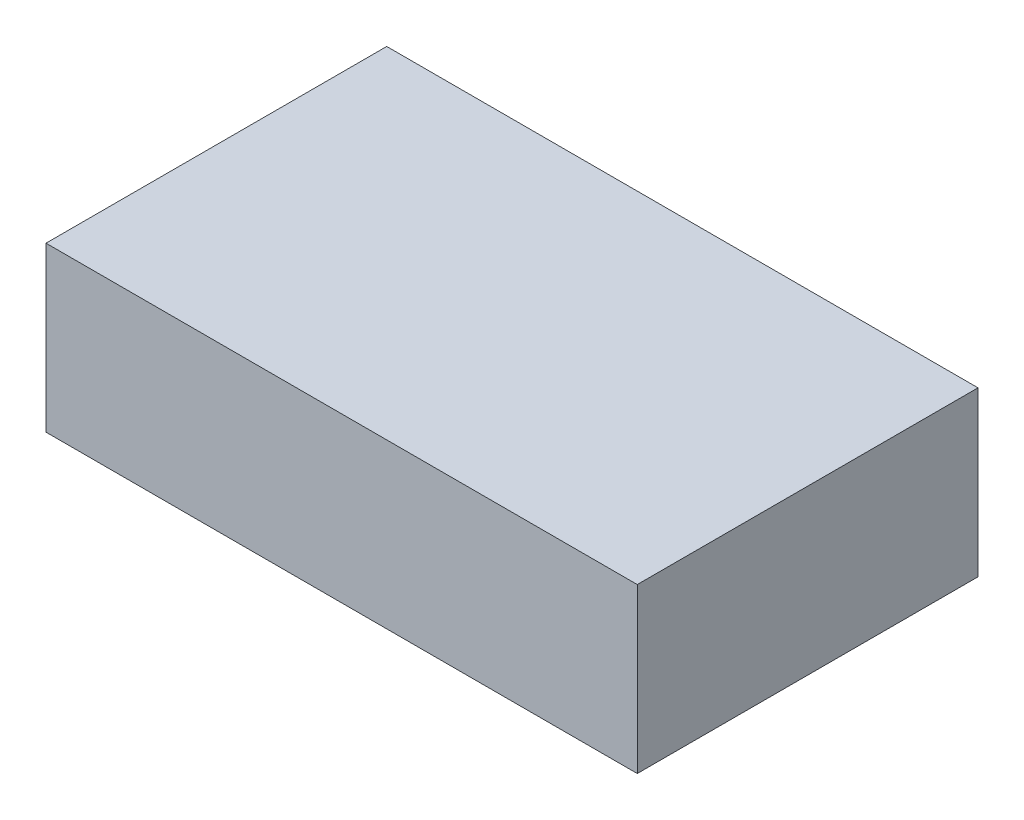
from build123d import *

# Parameters (mm, degrees)
SKETCH1_W           = 177
SKETCH1_H           = 102
BOSS_EXTRUDE1_DEPTH = 49


with BuildPart() as part:
    # Sketch1 → Boss-Extrude1 (new body)
    with BuildSketch(Plane(origin=(0, 0, 0), x_dir=(1, 0, 0), z_dir=(0, 1, 0))):
        Rectangle(SKETCH1_W, SKETCH1_H)
    extrude(amount=BOSS_EXTRUDE1_DEPTH)


solid = part.part
